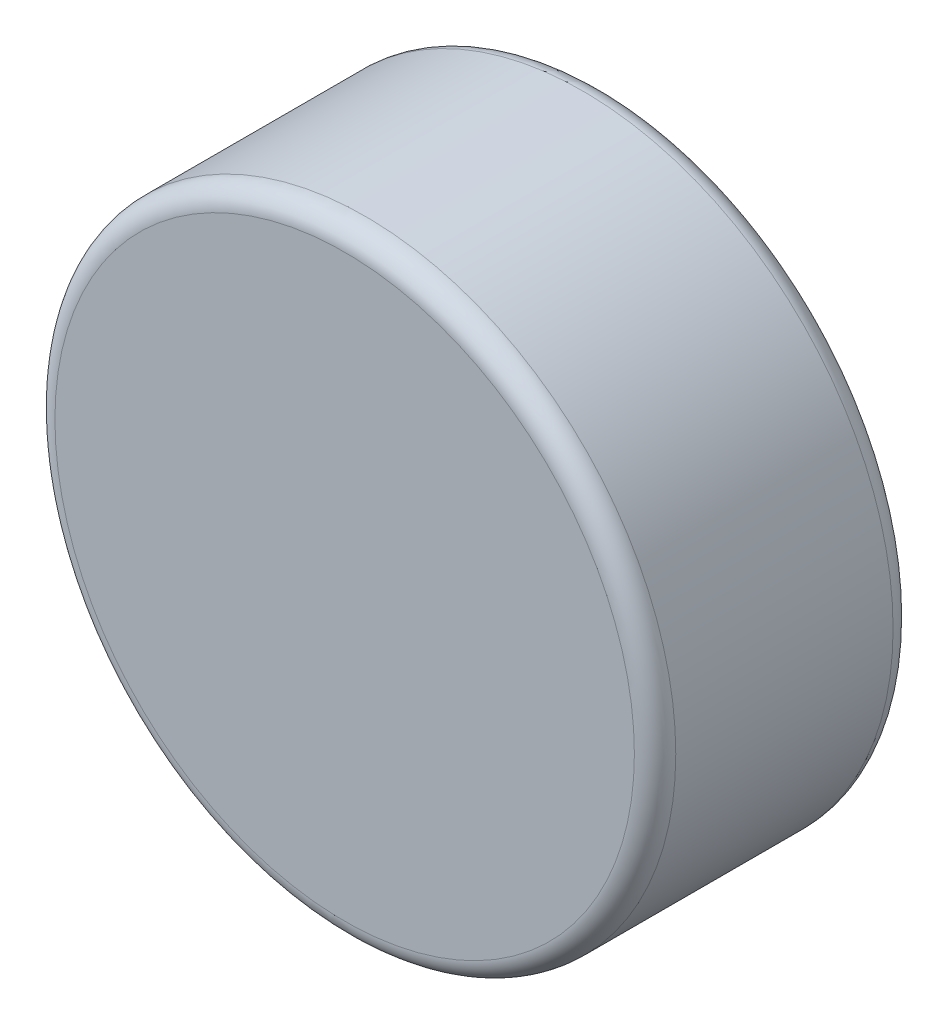
from build123d import *

# Parameters (mm, degrees)
SKETCH_1_R      = 3
EXTRUDE_2_DEPTH = 2.5
FILLET_2_R      = 0.2


with BuildPart() as part:
    # 草图1 → 凸台-拉伸2 (new body)
    with BuildSketch(Plane.XY):
        Circle(SKETCH_1_R)
    extrude(amount=EXTRUDE_2_DEPTH)

    # 圆角2
    fillet_2_edges = [part.edges().sort_by_distance(p)[0] for p in [
        (-3, 0, 0),
        (-3, 0, 2.5),
    ]]
    fillet(fillet_2_edges, radius=FILLET_2_R)


solid = part.part
